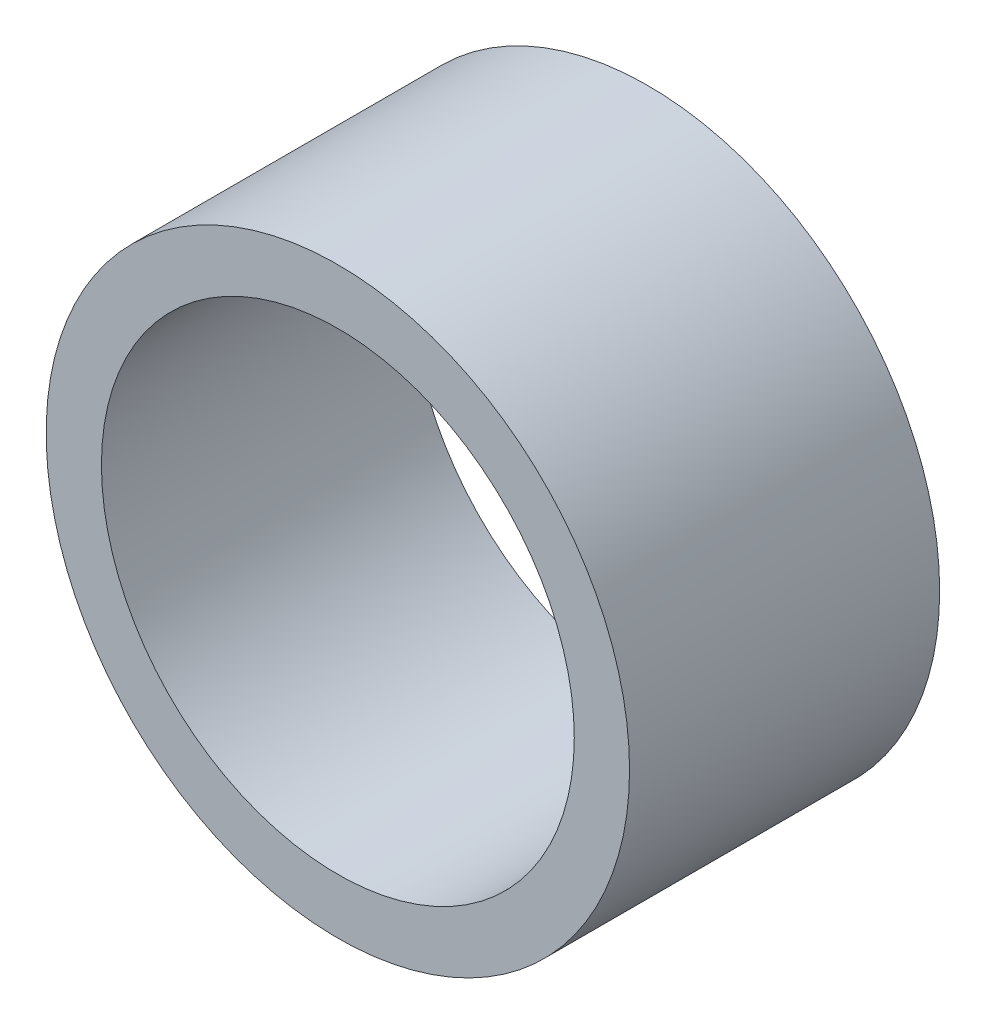
from build123d import *

# Parameters (mm, degrees)
SKETCH2_R           = 9.5
SKETCH2_R_2         = 7.7
BOSS_EXTRUDE1_DEPTH = 10.1


with BuildPart() as part:
    # Sketch2 → Boss-Extrude1 (new body)
    with BuildSketch(Plane.XY):
        Circle(SKETCH2_R)
        Circle(SKETCH2_R_2, mode=Mode.SUBTRACT)
    extrude(amount=-BOSS_EXTRUDE1_DEPTH)


solid = part.part
